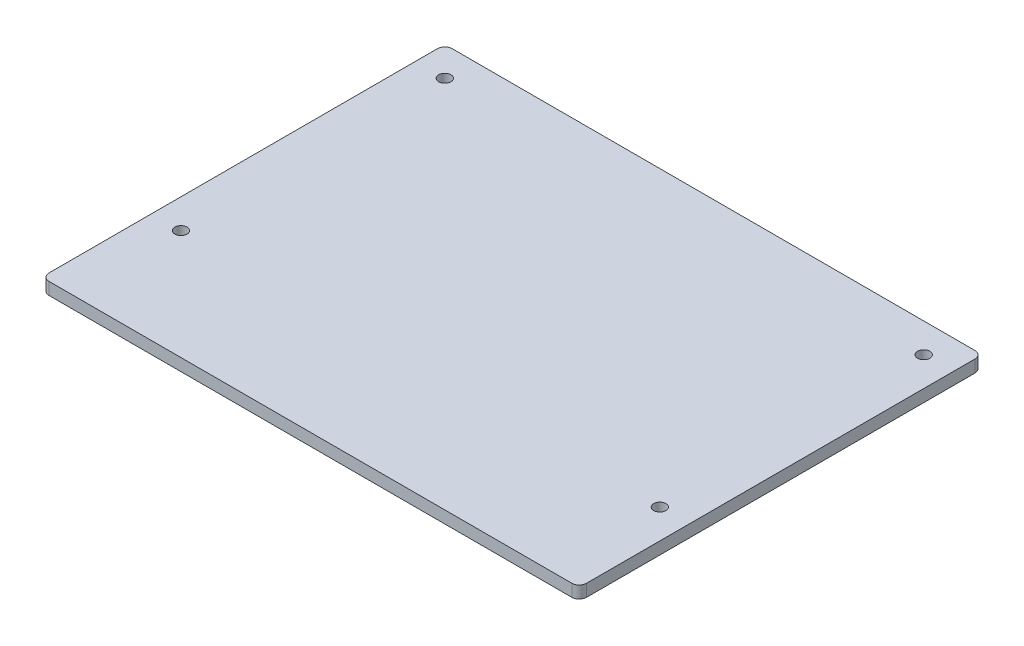
from build123d import *

# Parameters (mm, degrees)
SKETCH1_R           = 2.5
BOSS_EXTRUDE1_DEPTH = 5


with BuildPart() as part:
    # Sketch1 → Boss-Extrude1 (new body)
    with BuildSketch(Plane(origin=(0, 0, 0), x_dir=(1, 0, 0), z_dir=(0, 1, 0))):
        with BuildLine():
            Line((-107, 82.5), (107, 82.5))
            ThreePointArc((107, 82.5), (109.121320344, 81.621320344), (110, 79.5))
            Line((110, 79.5), (110, -79.5))
            ThreePointArc((110, -79.5), (109.121320344, -81.621320344), (107, -82.5))
            Line((107, -82.5), (-107, -82.5))
            ThreePointArc((-107, -82.5), (-109.121320344, -81.621320344), (-110, -79.5))
            Line((-110, -79.5), (-110, 79.5))
            ThreePointArc((-110, 79.5), (-109.121320344, 81.621320344), (-107, 82.5))
        make_face()
        with Locations(Location((-98, -37.5, 0), (0, 0, 270))):
            Circle(SKETCH1_R, mode=Mode.SUBTRACT)
        with Locations(Location((-98, 70.5, 0), (0, 0, 90))):
            Circle(SKETCH1_R, mode=Mode.SUBTRACT)
        with Locations(Location((98, 70.5, 0), (0, 0, 270))):
            Circle(SKETCH1_R, mode=Mode.SUBTRACT)
        with Locations(Location((98, -37.5, 0), (0, 0, 90))):
            Circle(SKETCH1_R, mode=Mode.SUBTRACT)
    extrude(amount=BOSS_EXTRUDE1_DEPTH)


solid = part.part
